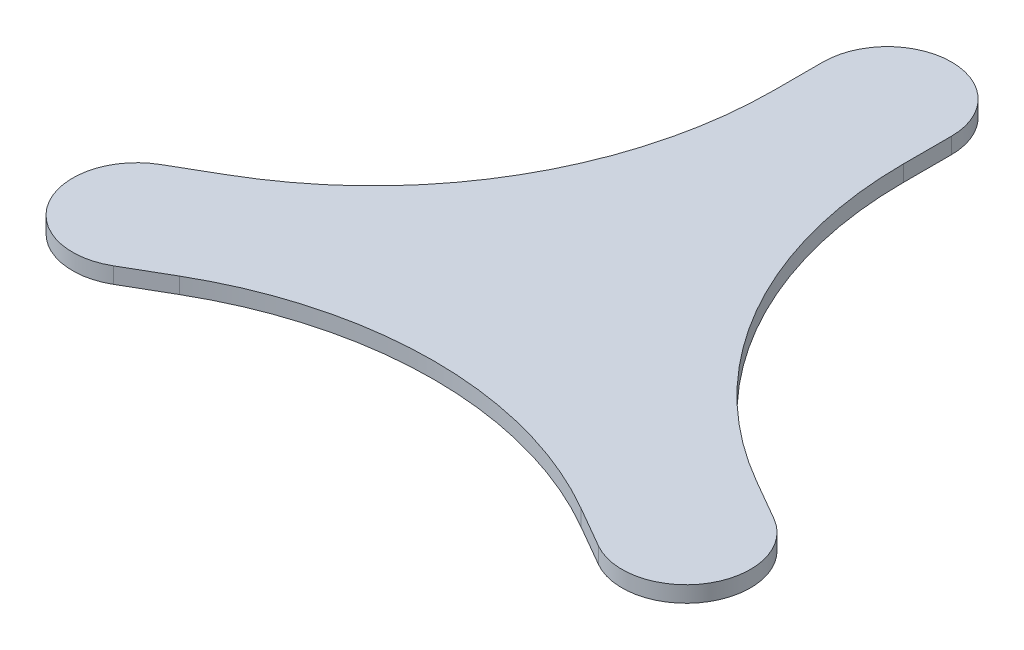
from build123d import *

# Parameters (mm, degrees)
BOSS_EXTRUDE2_DEPTH = 10


with BuildPart() as part:
    # Sketch1 → Boss-Extrude2 (new body)
    with BuildSketch(Plane(origin=(0, 0, 0), x_dir=(1, 0, 0), z_dir=(0, 1, 0))):
        with BuildLine():
            Line((40, 197.5), (40, 167.431578065))
            ThreePointArc((40, 167.431578065), (73.493649054, 42.431578065), (165, -49.074772881))
            Line((165, -49.074772881), (191.040017247, -64.108983849))
            ThreePointArc((191.040017247, -64.108983849), (205.681033399, -118.75), (151.040017247, -133.391016151))
            Line((151.040017247, -133.391016151), (125, -118.356805184))
            ThreePointArc((125, -118.356805184), (0, -84.86315613), (-125, -118.356805184))
            Line((-125, -118.356805184), (-151.040017247, -133.391016151))
            ThreePointArc((-151.040017247, -133.391016151), (-205.681033399, -118.75), (-191.040017247, -64.108983849))
            Line((-191.040017247, -64.108983849), (-165, -49.074772881))
            ThreePointArc((-165, -49.074772881), (-73.493649054, 42.431578065), (-40, 167.431578065))
            Line((-40, 167.431578065), (-40, 197.5))
            ThreePointArc((-40, 197.5), (0, 237.5), (40, 197.5))
        make_face()
    extrude(amount=BOSS_EXTRUDE2_DEPTH)


solid = part.part
